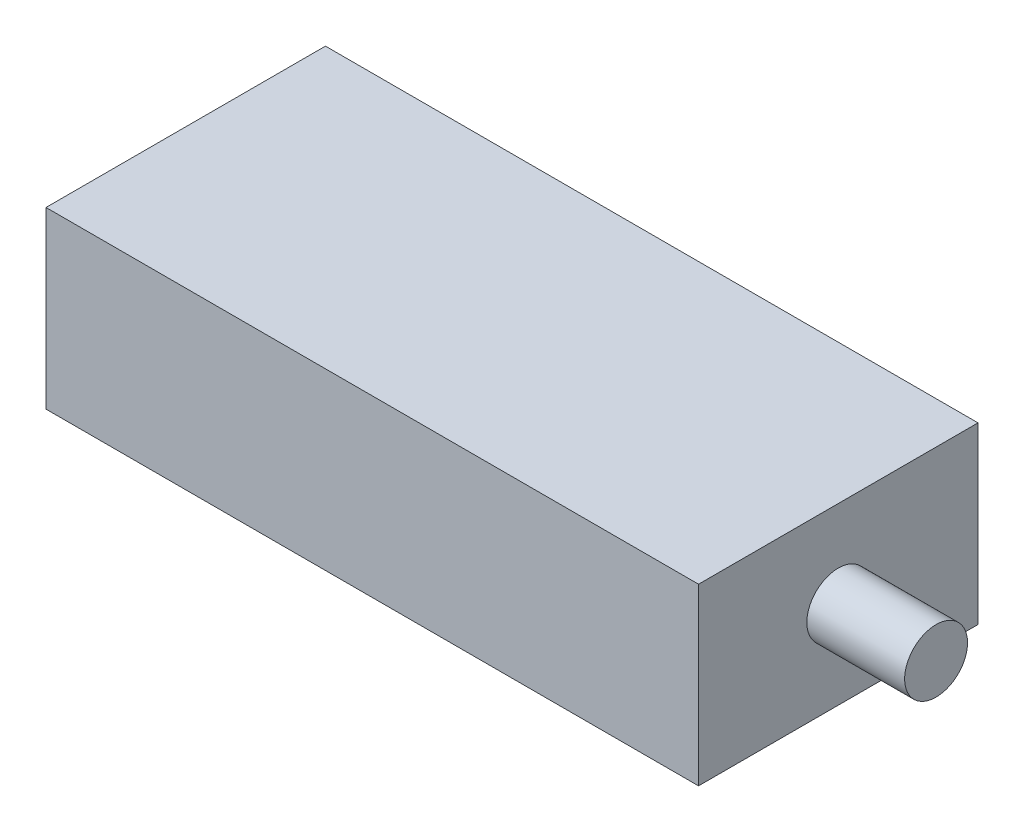
from build123d import *

# Parameters (mm, degrees)
SKETCH1_W           = 118.618
SKETCH1_H           = 50.8
BOSS_EXTRUDE1_DEPTH = 31.75
SKETCH2_R           = 5.715
BOSS_EXTRUDE2_DEPTH = 17.78
CUT_EXTRUDE1_DEPTH  = 9.906


with BuildPart() as part:
    # Sketch1 → Boss-Extrude1 (new body)
    with BuildSketch(Plane(origin=(0, 0, 0), x_dir=(1, 0, 0), z_dir=(0, 1, 0))):
        Rectangle(SKETCH1_W, SKETCH1_H)
    extrude(amount=BOSS_EXTRUDE1_DEPTH)

    # Sketch2 → Boss-Extrude2 (add)
    with BuildSketch(Plane(origin=(59.309, 0, 0), x_dir=(0, 0, -1), z_dir=(1, 0, 0))):
        with Locations((0, 15.875)):
            Circle(SKETCH2_R)
    extrude(amount=BOSS_EXTRUDE2_DEPTH)

    # Sketch3 → Cut-Extrude1 (cut)
    with BuildSketch(Plane.ZY.offset(59.309)):
        with BuildLine():
            Line((-7.963952601, 11.6586), (-2.54, 11.6586))
            Line((-2.54, 11.6586), (0, 14.1986))
            Line((0, 14.1986), (2.54, 11.6586))
            Line((2.54, 11.6586), (7.963952601, 11.6586))
            ThreePointArc((7.963952601, 11.6586), (10.210514576, 15.875), (7.963952601, 20.0914))
            Line((7.963952601, 20.0914), (2.54, 20.0914))
            Line((2.54, 20.0914), (0, 17.5514))
            Line((0, 17.5514), (-2.54, 20.0914))
            Line((-2.54, 20.0914), (-7.963952601, 20.0914))
            ThreePointArc((-7.963952601, 20.0914), (-10.210514576, 15.875), (-7.963952601, 11.6586))
        make_face()
    extrude(amount=-CUT_EXTRUDE1_DEPTH, mode=Mode.SUBTRACT)


solid = part.part
